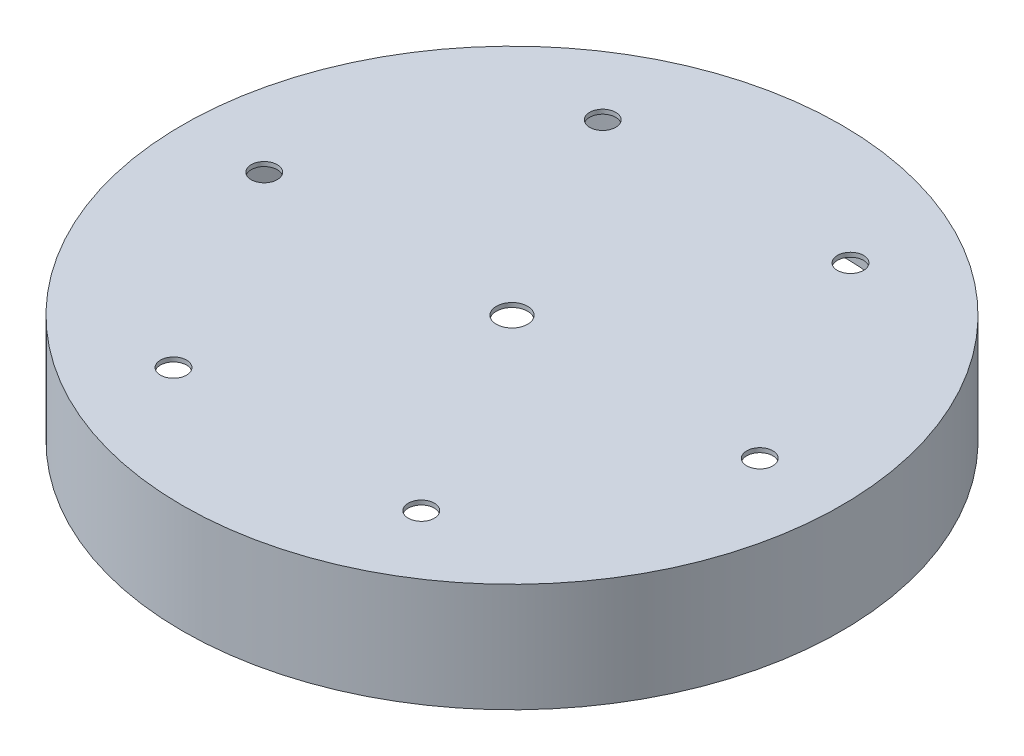
from build123d import *

# Parameters (mm, degrees)
SKETCH1_R                                  = 96.266
BOSS_EXTRUDE1_DEPTH                        = 31.75
SKETCH2_R                                  = 94.996
CUT_EXTRUDE1_DEPTH                         = 30.48
F_23_64_0_35938_DIAMETER_HOLE1_D           = 9.128252
F_23_64_0_35938_DIAMETER_HOLE1_ON_FACE_2_D = 9.128252
SKETCH5_R                                  = 3.81
CUT_EXTRUDE2_DEPTH                         = 22.86


with BuildPart() as part:
    # Sketch1 → Boss-Extrude1 (new body)
    with BuildSketch(Plane(origin=(0, 0, 0), x_dir=(1, 0, 0), z_dir=(0, 1, 0))):
        with Locations(Location((0, 0, 0), (0, 0, 270))):
            Circle(SKETCH1_R)
    extrude(amount=BOSS_EXTRUDE1_DEPTH)

    # Sketch2 → Cut-Extrude1 (cut)
    with BuildSketch(Plane.XZ):
        with Locations(Location((0, 0, 0), (0, 0, 270))):
            Circle(SKETCH2_R)
    extrude(amount=-CUT_EXTRUDE1_DEPTH, mode=Mode.SUBTRACT)

    # 23/64 (0.35938) Diameter Hole1 (through all)
    with Locations(Plane(origin=(1.163e-06, 31.75, -2.517e-06), x_dir=(0, 0, 1), z_dir=(0, 1, 0))):
        with Locations((0, 0)):
            Hole(F_23_64_0_35938_DIAMETER_HOLE1_D / 2)

    # 23/64 (0.35938) Diameter Hole1 on face 2 (through all)
    with Locations(Plane.ZX):
        with Locations((0, 0)):
            Hole(F_23_64_0_35938_DIAMETER_HOLE1_ON_FACE_2_D / 2)

    # Sketch5 → Cut-Extrude2 (cut)
    with BuildSketch(Plane(origin=(0, 31.75, 0), x_dir=(1, 0, 0), z_dir=(0, 1, 0))):
        with Locations(Location((72.382124837, 0, 0), (0, 0, 270))):
            Circle(SKETCH5_R)
        with Locations(Location((36.191062419, 62.684758889, 0), (0, 0, 270))):
            Circle(SKETCH5_R)
        with Locations(Location((-36.191062419, 62.684758889, 0), (0, 0, 270))):
            Circle(SKETCH5_R)
        with Locations(Location((-72.382124837, 0, 0), (0, 0, 270))):
            Circle(SKETCH5_R)
        with Locations(Location((-36.191062419, -62.684758889, 0), (0, 0, 270))):
            Circle(SKETCH5_R)
        with Locations(Location((36.191062419, -62.684758889, 0), (0, 0, 270))):
            Circle(SKETCH5_R)
    extrude(amount=-CUT_EXTRUDE2_DEPTH, mode=Mode.SUBTRACT)


solid = part.part
